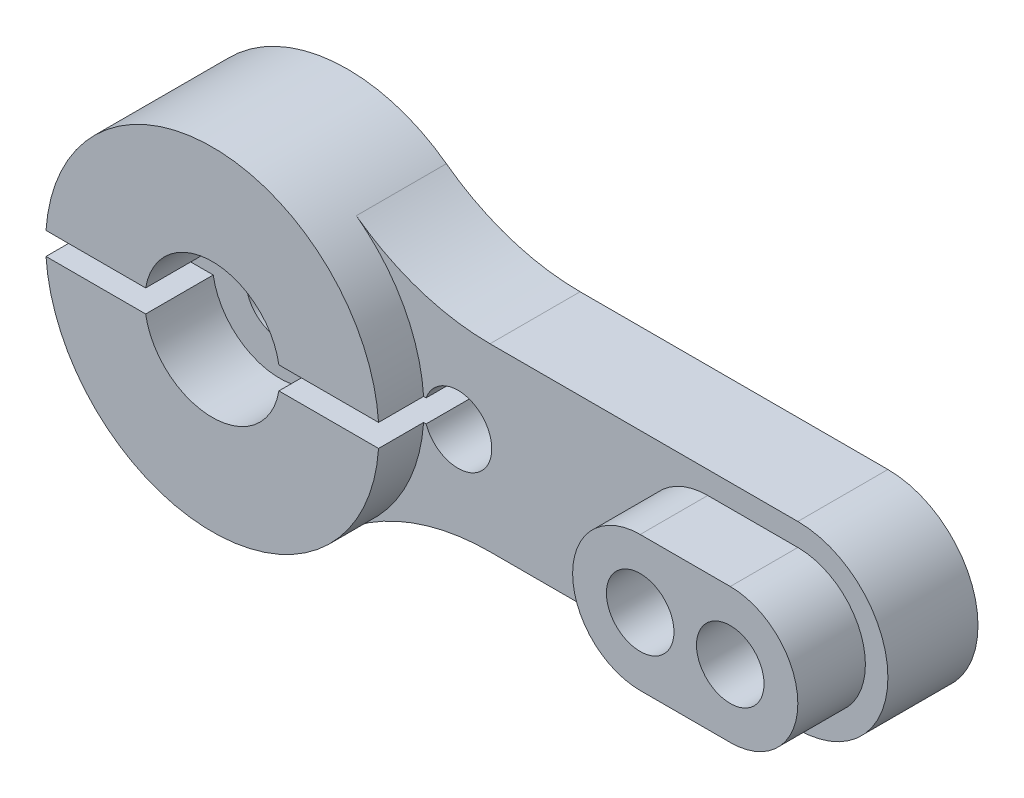
from build123d import *

# Parameters (mm, degrees)
EXTRUDE_1_DEPTH     = 4
SKETCH_3_R          = 7.4
EXTRUDE_2_DEPTH     = 2
EXTRUDE_3_DEPTH     = 3
CUT_EXTRUDE_1_DEPTH = 3
SKETCH_7_R          = 1.5
CUT_EXTRUDE_2_DEPTH = 30.795301643
CUT_EXTRUDE_3_DEPTH = 30.795301643
SKETCH_10_R         = 3.925
CUT_EXTRUDE_4_DEPTH = 1.5


with BuildPart() as part:
    # ｽｹｯﾁ2 → ﾎﾞｽ - 押し出し1 (new body)
    with BuildSketch(Plane.XY):
        with BuildLine():
            Line((24, 4), (10.332473082, 4))
            ThreePointArc((10.332473082, 4), (7.206754774, 4.50105874), (4.394270162, 5.954022989))
            ThreePointArc((4.394270162, 5.954022989), (-7.4, 0), (4.394270162, -5.954022989))
            ThreePointArc((4.394270162, -5.954022989), (7.206754774, -4.50105874), (10.332473082, -4))
            Line((10.332473082, -4), (24, -4))
            ThreePointArc((24, -4), (28, 0), (24, 4))
        make_face()
    extrude(amount=EXTRUDE_1_DEPTH)

    # ｽｹｯﾁ3 → ﾎﾞｽ - 押し出し2 (add)
    with BuildSketch(Plane.XY.offset(4)):
        with Locations(Location((0, 0, 0), (0, 0, 53.571420986))):
            Circle(SKETCH_3_R)
    extrude(amount=EXTRUDE_2_DEPTH)

    # ｽｹｯﾁ4 → ﾎﾞｽ - 押し出し3 (add)
    with BuildSketch(Plane.XY.offset(4)):
        with BuildLine():
            Line((24, -3), (20, -3))
            ThreePointArc((20, -3), (17, 0), (20, 3))
            Line((20, 3), (24, 3))
            ThreePointArc((24, 3), (27, 0), (24, -3))
        make_face()
    extrude(amount=EXTRUDE_3_DEPTH)

    # ｽｹｯﾁ6 → ｶｯﾄ - 押し出し1 (cut)
    with BuildSketch(Plane.XY.offset(6)):
        with BuildLine():
            Line((7.4, 0.5), (2.958039892, 0.5))
            ThreePointArc((2.958039892, 0.5), (0, 3), (-2.958039892, 0.5))
            Line((-2.958039892, 0.5), (-7.4, 0.5))
            Line((-7.4, 0.5), (-7.4, -0.5))
            Line((-7.4, -0.5), (-2.958039892, -0.5))
            ThreePointArc((-2.958039892, -0.5), (0, -3), (2.958039892, -0.5))
            Line((2.958039892, -0.5), (7.4, -0.5))
            Line((7.4, -0.5), (7.4, 0.5))
        make_face()
    extrude(amount=-CUT_EXTRUDE_1_DEPTH, mode=Mode.SUBTRACT)

    # ｽｹｯﾁ7 → ｶｯﾄ - 押し出し2 (cut, through all)
    with BuildSketch(Plane.XY.offset(7)):
        with Locations((20, 0)):
            Circle(SKETCH_7_R)
        with Locations(Location((24, 0, 0), (0, 0, 180))):
            Circle(SKETCH_7_R)
    extrude(amount=-CUT_EXTRUDE_2_DEPTH, mode=Mode.SUBTRACT)

    # ｽｹｯﾁ8 → ｶｯﾄ - 押し出し3 (cut, through all)
    with BuildSketch(Plane(origin=(0, 0, 0), x_dir=(-1, 0, 0), z_dir=(0, 0, -1))):
        with BuildLine():
            ThreePointArc((-1.414213562, -0.5), (1.5, 0), (-1.414213562, 0.5))
            Line((-1.414213562, 0.5), (-7.495786438, 0.5))
            ThreePointArc((-7.495786438, 0.5), (-10.41, 0), (-7.495786438, -0.5))
            Line((-7.495786438, -0.5), (-1.414213562, -0.5))
        make_face()
    extrude(amount=-CUT_EXTRUDE_3_DEPTH, mode=Mode.SUBTRACT)

    # ｽｹｯﾁ10 → ｶｯﾄ - 押し出し4 (cut)
    with BuildSketch(Plane(origin=(0, 0, 0), x_dir=(-1, 0, 0), z_dir=(0, 0, -1))):
        Circle(SKETCH_10_R)
    extrude(amount=-CUT_EXTRUDE_4_DEPTH, mode=Mode.SUBTRACT)


solid = part.part
